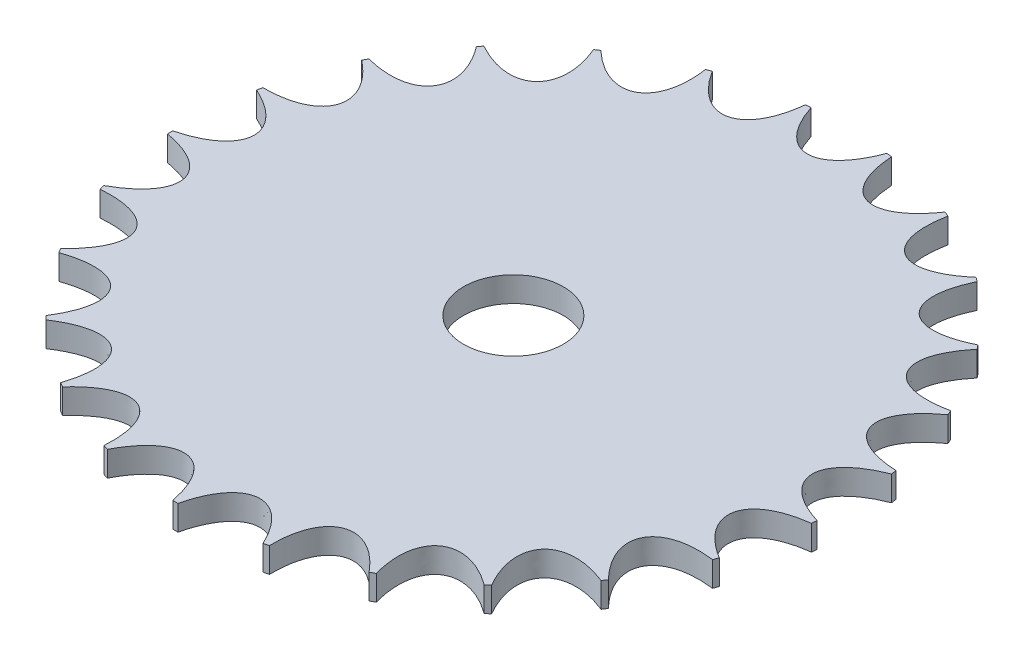
from build123d import *

# Parameters (mm, degrees)
SKETCH1_R           = 26.5
BOSS_EXTRUDE1_DEPTH = 2
CUT_EXTRUDE1_START  = -2
CUT_EXTRUDE1_DEPTH  = 2
CIRPATTERN2_COUNT   = 25
SKETCH4_R           = 4
CUT_EXTRUDE2_DEPTH  = 2


with BuildPart() as part:
    # Sketch1 → Boss-Extrude1 (new body)
    with BuildSketch(Plane(origin=(0, 0, 0), x_dir=(1, 0, 0), z_dir=(0, 1, 0))):
        with Locations(Location((0, 0, 0), (0, 0, 270))):
            Circle(SKETCH1_R)
    extrude(amount=BOSS_EXTRUDE1_DEPTH)

    # Sketch2 → Cut-Extrude1 (cut)
    with BuildSketch(Plane(origin=(0, 2, 0), x_dir=(1, 0, 0), z_dir=(0, 1, 0)).offset(CUT_EXTRUDE1_START)):
        with BuildLine():
            ThreePointArc((20.67056927, 16.582447529), (18.581221902, 18.894131169), (16.234972011, 20.944586026))
            add(Edge.make_bspline(
                [(16.234972011, 20.944586026), (12.135241932, 12.33960038), (20.67056927, 16.582447529)],
                knots=[0, 0, 0, 1, 1, 1], degree=2, weights=[1, 0.580612476, 1]))
        make_face()
    cut_extrude1 = extrude(amount=CUT_EXTRUDE1_DEPTH, mode=Mode.SUBTRACT)

    # CirPattern2: Cut-Extrude1 ×25 about axis
    cirpattern2_axis = Axis((0, 2, 0), (0, -1, 0))
    for i in range(1, CIRPATTERN2_COUNT):
        add(cut_extrude1.rotate(cirpattern2_axis, i * 360 / CIRPATTERN2_COUNT), mode=Mode.SUBTRACT)

    # Sketch4 → Cut-Extrude2 (cut)
    with BuildSketch(Plane(origin=(0, 2, 0), x_dir=(1, 0, 0), z_dir=(0, 1, 0))):
        with Locations(Location((0, 0, 0), (0, 0, 270))):
            Circle(SKETCH4_R)
    extrude(amount=-CUT_EXTRUDE2_DEPTH, mode=Mode.SUBTRACT)


solid = part.part
